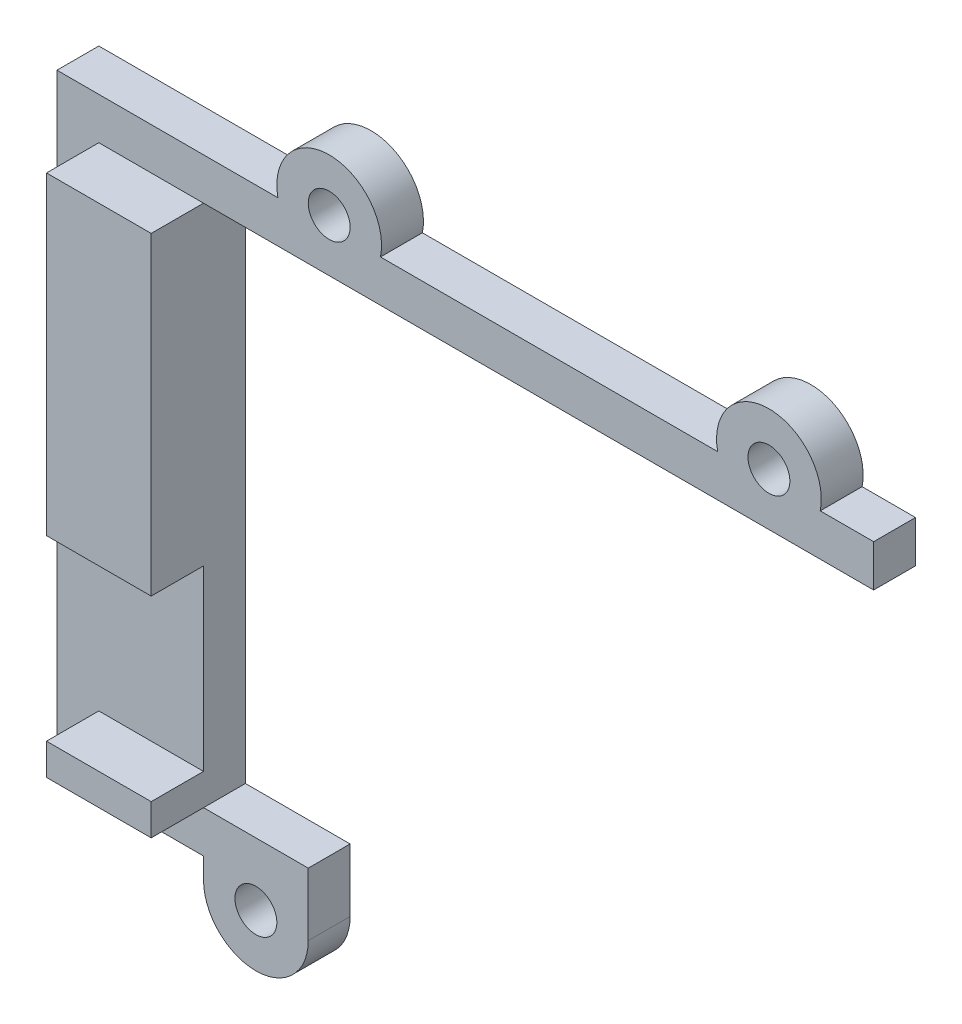
from build123d import *

# Parameters (mm, degrees)
SKETCH1_W          = 5
SKETCH1_H          = 15
CLAMP_PART_DEPTH   = 2.5
SKETCH1_H_2        = 1.5
CLAMP_PART_2_DEPTH = 2.5
SKETCH2_R          = 1
OUTSIDE_DEPTH      = 2


with BuildPart() as part:
    # Sketch1 → Clamp part (new body)
    with BuildSketch(Plane(origin=(0, 0, -7), x_dir=(-1, 0, 0), z_dir=(0, 0, -1))):
        with Locations((19, 34)):
            Rectangle(SKETCH1_W, SKETCH1_H)
    extrude(amount=-CLAMP_PART_DEPTH)



with BuildPart() as body_2:
    # Sketch1 → Clamp part 2 (new body)
    with BuildSketch(Plane(origin=(0, 0, -7), x_dir=(-1, 0, 0), z_dir=(0, 0, -1))):
        with Locations((19, 17.25)):
            Rectangle(SKETCH1_W, SKETCH1_H_2)
    extrude(amount=-CLAMP_PART_2_DEPTH)


with BuildPart() as part_1:
    add(part.part)

    add(body_2.part)  # Outside merges body 2
    # Sketch2 → Outside (add)
    with BuildSketch(Plane(origin=(0, 0, -7), x_dir=(-1, 0, 0), z_dir=(0, 0, -1))):
        with BuildLine():
            Line((23.5, 43.5), (16.5, 43.5))
            Line((16.5, 43.5), (12.949489743, 43.5))
            ThreePointArc((12.949489743, 43.5), (10.5, 46.5), (8.050510257, 43.5))
            Line((8.050510257, 43.5), (-8.050510257, 43.5))
            ThreePointArc((-8.050510257, 43.5), (-10.5, 46.5), (-12.949489743, 43.5))
            Line((-12.949489743, 43.5), (-15.5, 43.5))
            Line((-15.5, 43.5), (-15.5, 41.5))
            Line((-15.5, 41.5), (16.5, 41.5))
            Line((16.5, 41.5), (16.5, 16.5))
            Line((16.5, 16.5), (11.5, 16.5))
            Line((11.5, 16.5), (11.5, 13.5))
            ThreePointArc((11.5, 13.5), (14, 11), (16.5, 13.5))
            Line((16.5, 13.5), (16.5, 14.5))
            Line((16.5, 14.5), (23.5, 14.5))
            Line((23.5, 14.5), (23.5, 43.5))
        make_face()
        with Locations((-10.5, 44)):
            Circle(SKETCH2_R, mode=Mode.SUBTRACT)
        with Locations((10.5, 44)):
            Circle(SKETCH2_R, mode=Mode.SUBTRACT)
        with Locations((14, 13.5)):
            Circle(SKETCH2_R, mode=Mode.SUBTRACT)
    extrude(amount=OUTSIDE_DEPTH)


solid = part_1.part
